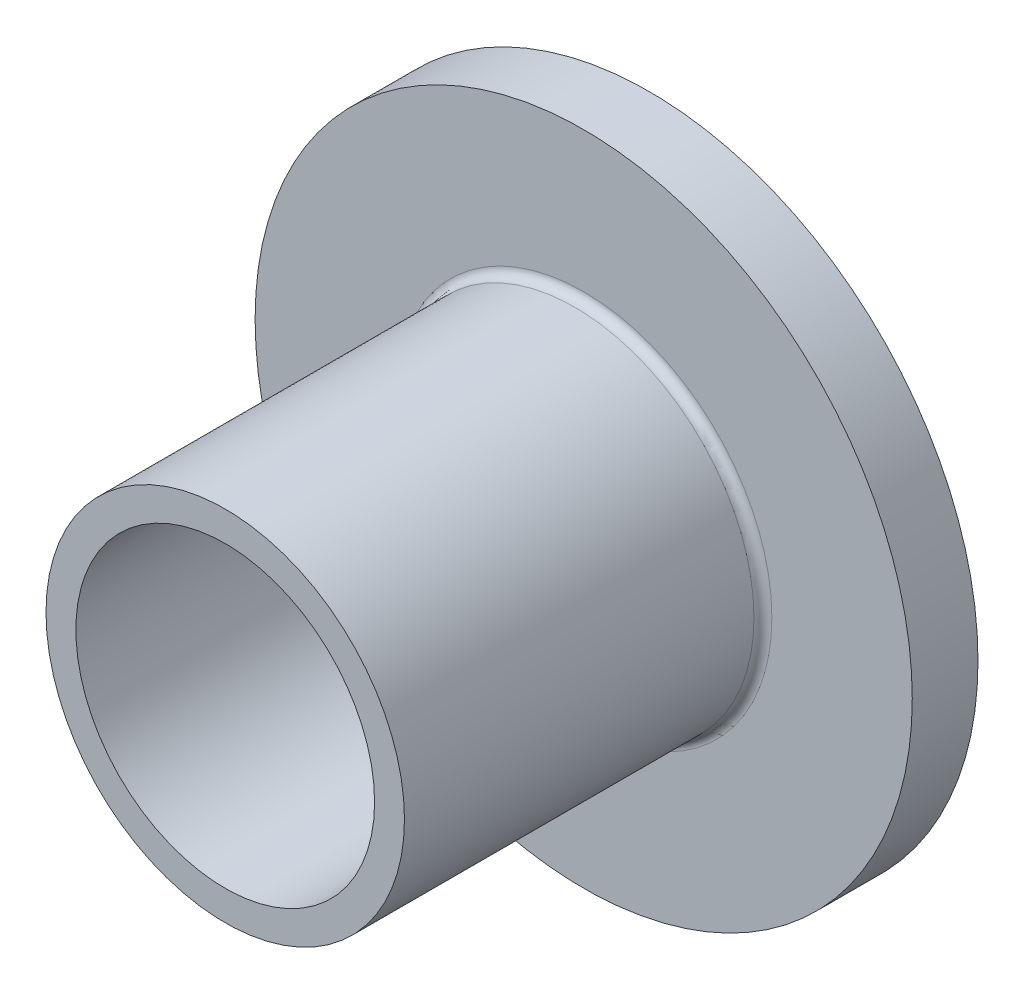
from build123d import *

# Parameters (mm, degrees)
SKETCH1_R                = 110
BOSS_EXTRUDE1_DEPTH      = 22
BOSS_EXTRUDE2_DEPTH      = 120
BOSS_EXTRUDE2_DEPTH_BACK = 22
SKETCH2_R                = 60
CUT_EXTRUDE3_DEPTH       = 211.627633515
CUT_EXTRUDE3_DEPTH_BACK  = 120
SKETCH3_R                = 50
FILLET1_R                = 3


with BuildPart() as part:
    # Sketch1 → Boss-Extrude1 (new body)
    with BuildSketch(Plane.XY):
        Circle(SKETCH1_R)
    extrude(amount=BOSS_EXTRUDE1_DEPTH)

    # Sketch2 → Boss-Extrude2 (add, two sides: drawn at the far end of the back side and taken through both)
    with BuildSketch(Plane.XY.offset(22).offset(-BOSS_EXTRUDE2_DEPTH_BACK)):
        Circle(SKETCH2_R)
    extrude(amount=BOSS_EXTRUDE2_DEPTH + BOSS_EXTRUDE2_DEPTH_BACK)

    # Sketch3 → Cut-Extrude3 (cut, two sides: drawn at the far end of the back side and taken through both)
    with BuildSketch(Plane.XY.offset(-CUT_EXTRUDE3_DEPTH_BACK)):
        Circle(SKETCH3_R)
    extrude(amount=CUT_EXTRUDE3_DEPTH + CUT_EXTRUDE3_DEPTH_BACK, mode=Mode.SUBTRACT)

    # Fillet1
    fillet1_edges = [part.edges().sort_by_distance(p)[0] for p in [
        (-60, 0, 22),
    ]]
    fillet(fillet1_edges, radius=FILLET1_R)


solid = part.part
